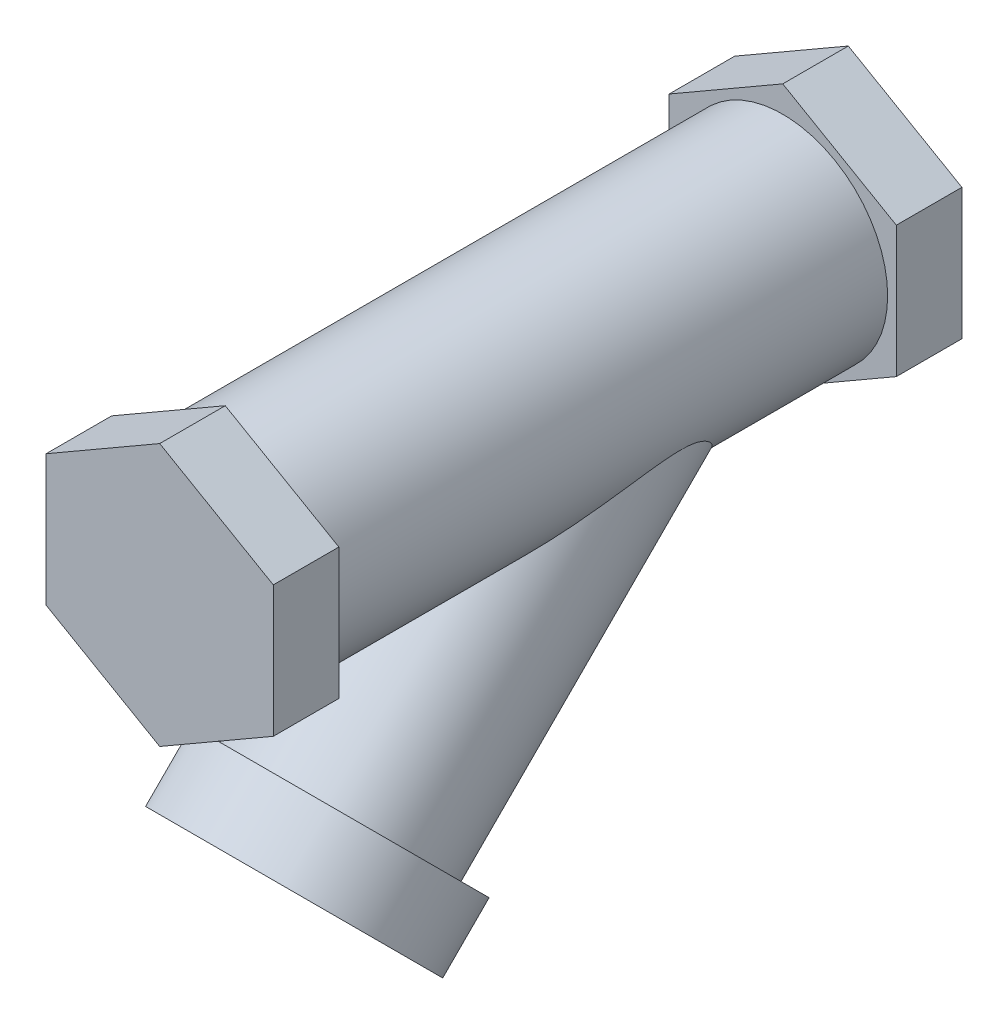
from build123d import *

# Parameters (mm, degrees)
SKETCH_3_R        = 16
EXTRUDE_417_DEPTH = 60
SKETCH_4_R        = 15
EXTRUDE_1_DEPTH   = 60
SKETCH_9_R        = 18.5
EXTRUDE_2_DEPTH   = 10
EXTRUDE_5_DEPTH   = 10
EXTRUDE_START     = 25
SKETCH_13_R       = 16
EXTRUDE_6_DEPTH   = 25
EXTRUDE_7_DEPTH   = 10


with BuildPart() as part:
    # Эскиз3 → Extrude 417 (new body)
    with BuildSketch(Plane.XY):
        Circle(SKETCH_3_R)
    extrude(amount=EXTRUDE_417_DEPTH)

    # Эскиз4 → Бобышка-Вытянуть1 (add)
    with BuildSketch(Plane(origin=(0, 0, 0), x_dir=(1, 0, 0), z_dir=(0, -0.707106781186544, 0.7071067811865511))):
        with Locations(Location((0, 0, 0), (0, 0, 158.211329465))):
            Circle(SKETCH_4_R)
    extrude(amount=EXTRUDE_1_DEPTH)

    # Эскиз9 → Бобышка-Вытянуть2 (add)
    with BuildSketch(Plane(origin=(0, -42.426406871, 42.426406871), x_dir=(1, 0, 0), z_dir=(0, -0.7071067811865441, 0.7071067811865509))):
        with Locations(Location((0, 0, 0), (0, 0, 270))):
            Circle(SKETCH_9_R)
    extrude(amount=EXTRUDE_2_DEPTH)

    # Эскиз12 → Бобышка-Вытянуть5 (add)
    with BuildSketch(Plane.XY.offset(60)):
        Polygon((0, 20), (-17.320508076, 10), (-17.320508076, -10), (0, -20), (17.320508076, -10), (17.320508076, 10), align=None)
    extrude(amount=EXTRUDE_5_DEPTH)

    # Эскиз13 → Бобышка-Вытянуть6 (add)
    with BuildSketch(Plane(origin=(0, 0, 0), x_dir=(-1, 0, 0), z_dir=(0, 0, -1)).offset(EXTRUDE_START)):
        Circle(SKETCH_13_R)
    extrude(amount=-EXTRUDE_6_DEPTH)

    # Эскиз14 → Бобышка-Вытянуть7 (add)
    with BuildSketch(Plane(origin=(0, 0, -25), x_dir=(-1, 0, 0), z_dir=(0, 0, -1))):
        Polygon((0, -20), (17.320508076, -10), (17.320508076, 10), (0, 20), (-17.320508076, 10), (-17.320508076, -10), align=None)
    extrude(amount=EXTRUDE_7_DEPTH)


solid = part.part
